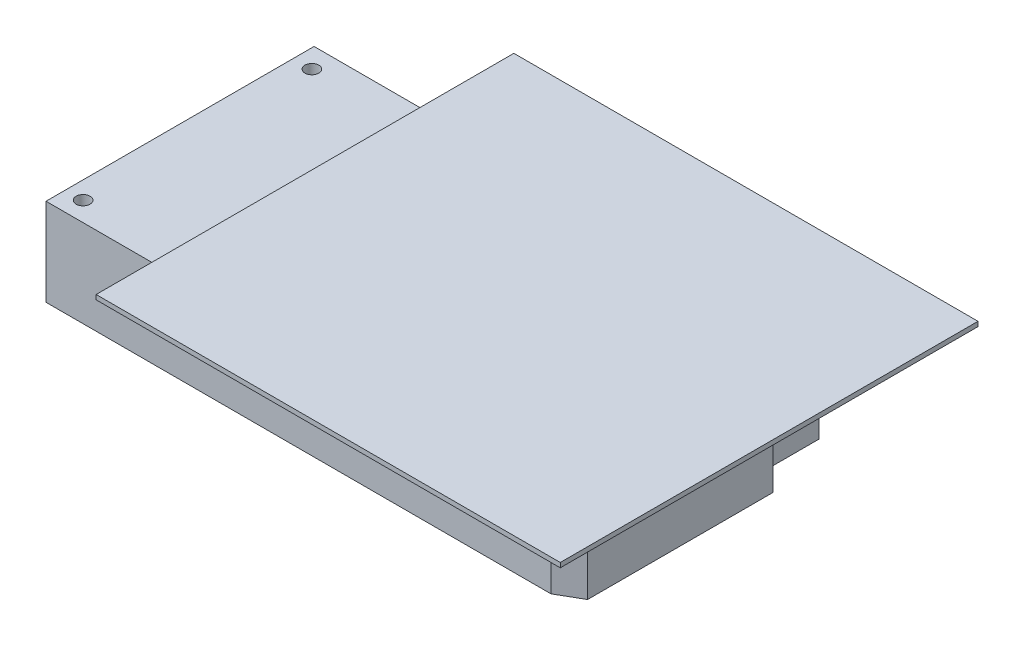
from build123d import *

# Parameters (mm, degrees)
SKETCH1_R           = 1.5
BOSS_EXTRUDE1_DEPTH = 18.86
SKETCH2_W           = 100
SKETCH2_H           = 90
BOSS_EXTRUDE2_DEPTH = 1


with BuildPart() as part:
    # Sketch1 → Boss-Extrude1 (new body)
    with BuildSketch(Plane(origin=(0, 0, 0), x_dir=(1, 0, 0), z_dir=(0, 1, 0))):
        Polygon((0, 0), (0, -57.76), (108.8, -57.76), (113.8, -54.88), (113.8, -14.88), (108.8, -12), (108.8, 0), align=None)
        with Locations(Location((66.5, -9.5, 0), (0, 0, 90))):
            Circle(SKETCH1_R, mode=Mode.SUBTRACT)
        with Locations(Location((4, -4.47, 0), (0, 0, 90))):
            Circle(SKETCH1_R, mode=Mode.SUBTRACT)
        with Locations(Location((3.8, -53.57, 0), (0, 0, 90))):
            Circle(SKETCH1_R, mode=Mode.SUBTRACT)
        with Locations(Location((66.5, -48.26, 0), (0, 0, 90))):
            Circle(SKETCH1_R, mode=Mode.SUBTRACT)
    extrude(amount=BOSS_EXTRUDE1_DEPTH)

    # Sketch2 → Boss-Extrude2 (add)
    with BuildSketch(Plane(origin=(0, 18.86, 0), x_dir=(1, 0, 0), z_dir=(0, 1, 0))):
        with Locations((73.8, -25.76)):
            Rectangle(SKETCH2_W, SKETCH2_H)
    extrude(amount=BOSS_EXTRUDE2_DEPTH)


solid = part.part
